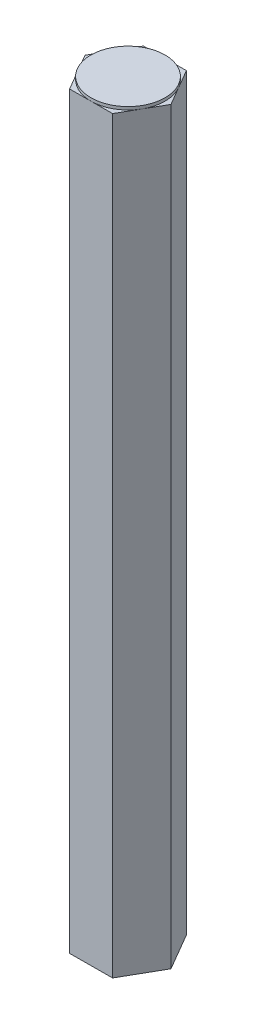
from build123d import *

# Parameters (mm, degrees)
BOSS_EXTRUDE1_DEPTH = 64.135
SKETCH2_R           = 3.175
BOSS_EXTRUDE2_DEPTH = 0.254


with BuildPart() as part:
    # Sketch1 → Boss-Extrude1 (new body)
    with BuildSketch(Plane(origin=(0, 0, 0), x_dir=(1, 0, 0), z_dir=(0, 1, 0))):
        Polygon((1.820388385, 3.182297827), (-1.845756569, 3.1676515), (-3.666144953, -0.014646328), (-1.820388385, -3.182297827), (1.845756569, -3.1676515), (3.666144953, 0.014646328), align=None)
    extrude(amount=BOSS_EXTRUDE1_DEPTH)

    # Sketch2 → Boss-Extrude2 (add)
    with BuildSketch(Plane(origin=(0, 64.135, 0), x_dir=(1, 0, 0), z_dir=(0, 1, 0))):
        with Locations(Location((0, 0, 0), (0, 0, 90.228896653))):
            Circle(SKETCH2_R)
    extrude(amount=BOSS_EXTRUDE2_DEPTH)


solid = part.part
